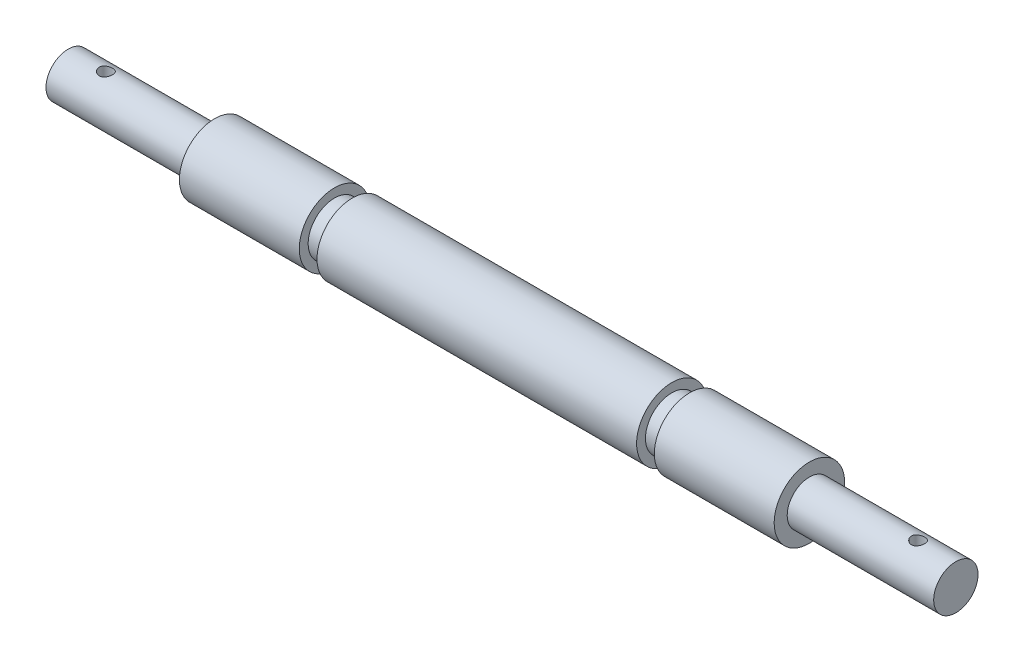
from build123d import *

# Parameters (mm, degrees)
ESBO_O3_R             = 1.5
CORTE_EXTRUS_O1_DEPTH = 101.628066723


with BuildPart() as part:
    # Esboço2 → Revolução1 (revolve)
    with BuildSketch(Plane.XY, mode=Mode.PRIVATE) as revolu_o1_sk:
        Polygon((67, 7.9375), (40, 7.9375), (40, 5.9375), (36, 5.9375), (36, 7.9375), (-36, 7.9375), (-36, 5.9375), (-40, 5.9375), (-40, 7.9375), (-67, 7.9375), (-67, 5), (-100, 5), (-100, 0), (100, 0), (100, 5), (67, 5), align=None)
    revolve(revolu_o1_sk.sketch.rotate(Axis((-100, 0, 0), (1, 0, 0)), 90), axis=Axis((-100, 0, 0), (1, 0, 0)))

    # Esboço3 → Corte-extrusão1 (cut, symmetric)
    with BuildSketch(Plane(origin=(0, 0, 0), x_dir=(1, 0, 0), z_dir=(0, 1, 0))):
        with Locations(Location((-91.5, 0, 0), (0, 0, 270))):
            Circle(ESBO_O3_R)
    corte_extrus_o1 = extrude(amount=CORTE_EXTRUS_O1_DEPTH, both=True, mode=Mode.SUBTRACT)

    # Espelhar1: Corte-extrusão1 across plane
    add(corte_extrus_o1.mirror(Plane(origin=(0, 0, 0), x_dir=(0, 0, 1), z_dir=(1, 0, 0))), mode=Mode.SUBTRACT)


solid = part.part
